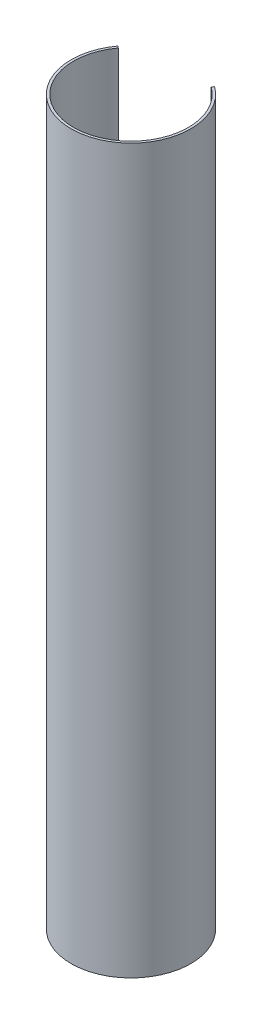
from build123d import *

# Parameters (mm, degrees)
BOSS_EXTRUDE1_DEPTH = 1510


with BuildPart() as part:
    # Sketch2 → Boss-Extrude1 (new body)
    with BuildSketch(Plane(origin=(0, 0, 0), x_dir=(1, 0, 0), z_dir=(0, 1, 0))):
        with BuildLine():
            ThreePointArc((70.554092404, 97.067605539), (106.926355704, 54.467921346), (120, 0))
            Line((120, 0), (125, 0))
            ThreePointArc((125, 0), (111.381620526, 56.737418069), (73.493846254, 101.112089103))
            Line((73.493846254, 101.112089103), (70.554092404, 97.067605539))
        make_face()
        with BuildLine():
            Line((-125, 0), (-120, 0))
            ThreePointArc((-120, 0), (-114.122987747, 37.093714665), (-97.067605539, 70.554092404))
            Line((-97.067605539, 70.554092404), (-101.112089103, 73.493846254))
            ThreePointArc((-101.112089103, 73.493846254), (-118.878112237, 38.63928611), (-125, 0))
        make_face()
        with BuildLine():
            Line((125, 0), (120, 0))
            ThreePointArc((120, 0), (0, -120), (-120, 0))
            Line((-120, 0), (-125, 0))
            ThreePointArc((-125, 0), (0, -125), (125, 0))
        make_face()
    extrude(amount=BOSS_EXTRUDE1_DEPTH)


solid = part.part
